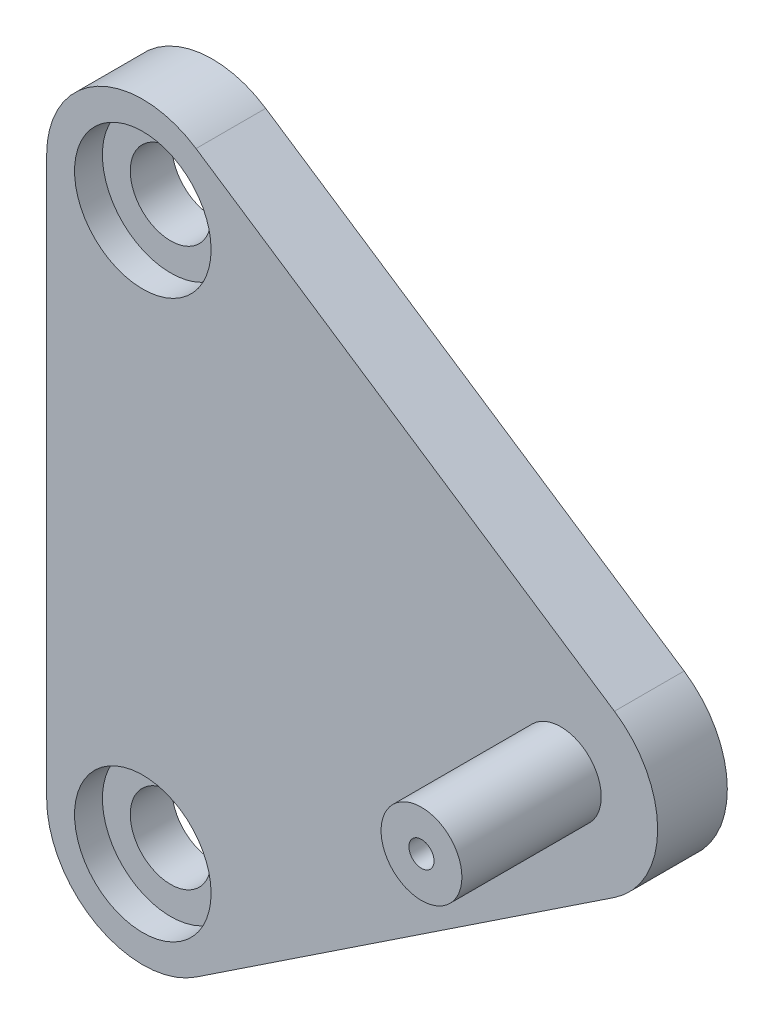
from build123d import *

# Parameters (mm, degrees)
CROQUIS1_R              = 1.45
SALIENTE_EXTRUIR1_DEPTH = 2.5
CROQUIS2_R              = 2.45
CORTAR_EXTRUIR1_DEPTH   = 1
CROQUIS3_R              = 1.45
CROQUIS3_R_2            = 0.45
SALIENTE_EXTRUIR2_DEPTH = 5
CROQUIS4_R              = 0.45
CORTAR_EXTRUIR2_DEPTH   = 24.392907579


with BuildPart() as part:
    # Croquis1 → Saliente-Extruir1 (new body)
    with BuildSketch(Plane.XY):
        with BuildLine():
            Line((-3.45, 10), (-3.45, -10))
            ThreePointArc((-3.45, -10), (-1.630018545, -13.040647882), (1.909733068, -12.873224601))
            Line((1.909733068, -12.873224601), (16.923571713, -2.89404507))
            ThreePointArc((16.923571713, -2.89404507), (18.475, 0), (16.923571713, 2.89404507))
            Line((16.923571713, 2.89404507), (1.909733068, 12.873224601))
            ThreePointArc((1.909733068, 12.873224601), (-1.630018545, 13.040647882), (-3.45, 10))
        make_face()
        with Locations((0, 10)):
            Circle(CROQUIS1_R, mode=Mode.SUBTRACT)
        with Locations(Location((0, -10, 0), (0, 0, 180))):
            Circle(CROQUIS1_R, mode=Mode.SUBTRACT)
    extrude(amount=SALIENTE_EXTRUIR1_DEPTH)

    # Croquis2 → Cortar-Extruir1 (cut)
    with BuildSketch(Plane.XY.offset(2.5)):
        with Locations((0, 10)):
            Circle(CROQUIS2_R)
        with Locations((0, -10)):
            Circle(CROQUIS2_R)
    extrude(amount=-CORTAR_EXTRUIR1_DEPTH, mode=Mode.SUBTRACT)

    # Croquis3 → Saliente-Extruir2 (add)
    with BuildSketch(Plane.XY.offset(2.5)):
        with Locations((15, 0)):
            Circle(CROQUIS3_R)
        with Locations((15, 0)):
            Circle(CROQUIS3_R_2, mode=Mode.SUBTRACT)
    extrude(amount=SALIENTE_EXTRUIR2_DEPTH)

    # Croquis4 → Cortar-Extruir2 (cut, through all)
    with BuildSketch(Plane.XY.offset(2.5)):
        with Locations((15, 0)):
            Circle(CROQUIS4_R)
    extrude(amount=-CORTAR_EXTRUIR2_DEPTH, mode=Mode.SUBTRACT)


solid = part.part
